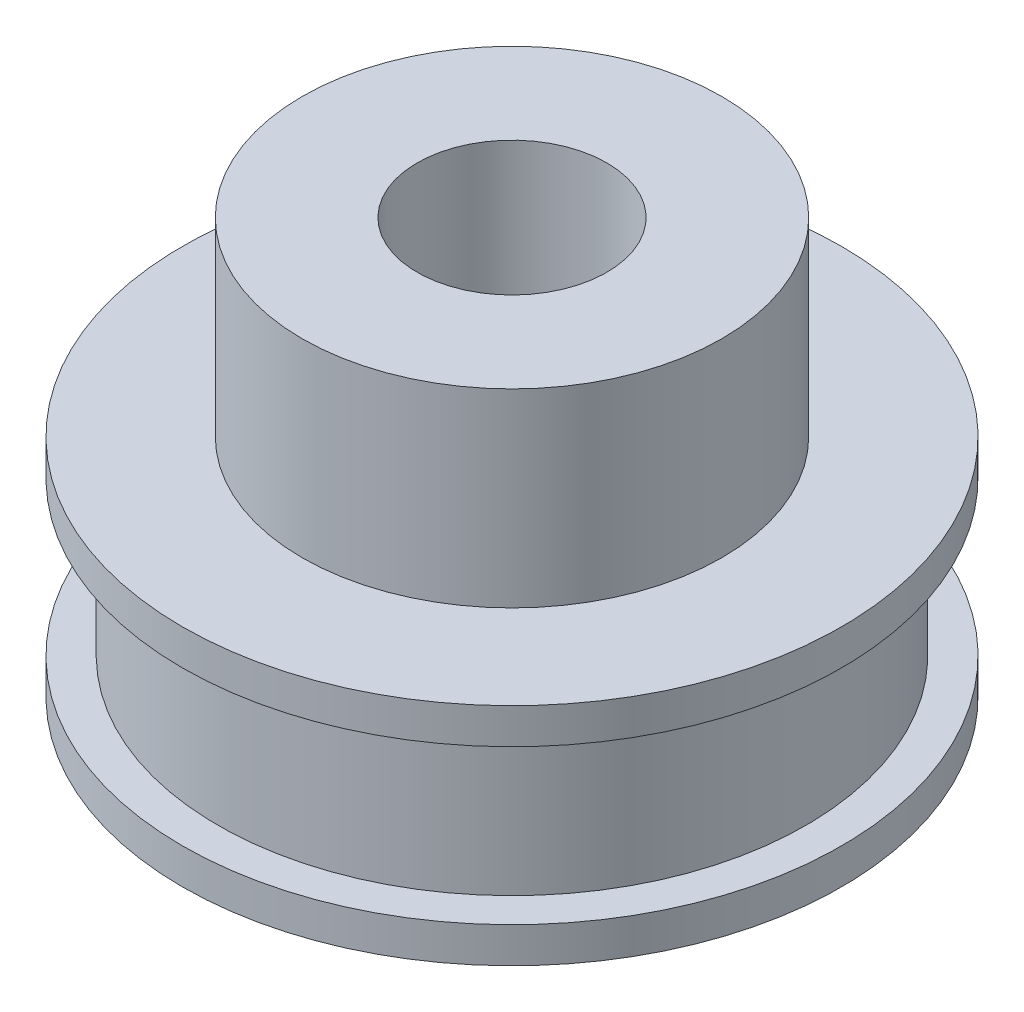
from build123d import *


with BuildPart() as part:
    # Esquisse1 → Révolution1 (revolve)
    with BuildSketch(Plane.XY, mode=Mode.PRIVATE) as r_volution1_sk:
        Polygon((4, 0), (13.9, 0), (13.9, 1.5), (12.4, 1.5), (12.4, 8), (13.9, 8), (13.9, 9.5), (8.85, 9.5), (8.85, 17.5), (4, 17.5), align=None)
    revolve(r_volution1_sk.sketch.rotate(Axis((0, 0, 0), (0, 1, 0)), 90), axis=Axis((0, 0, 0), (0, 1, 0)))


solid = part.part
